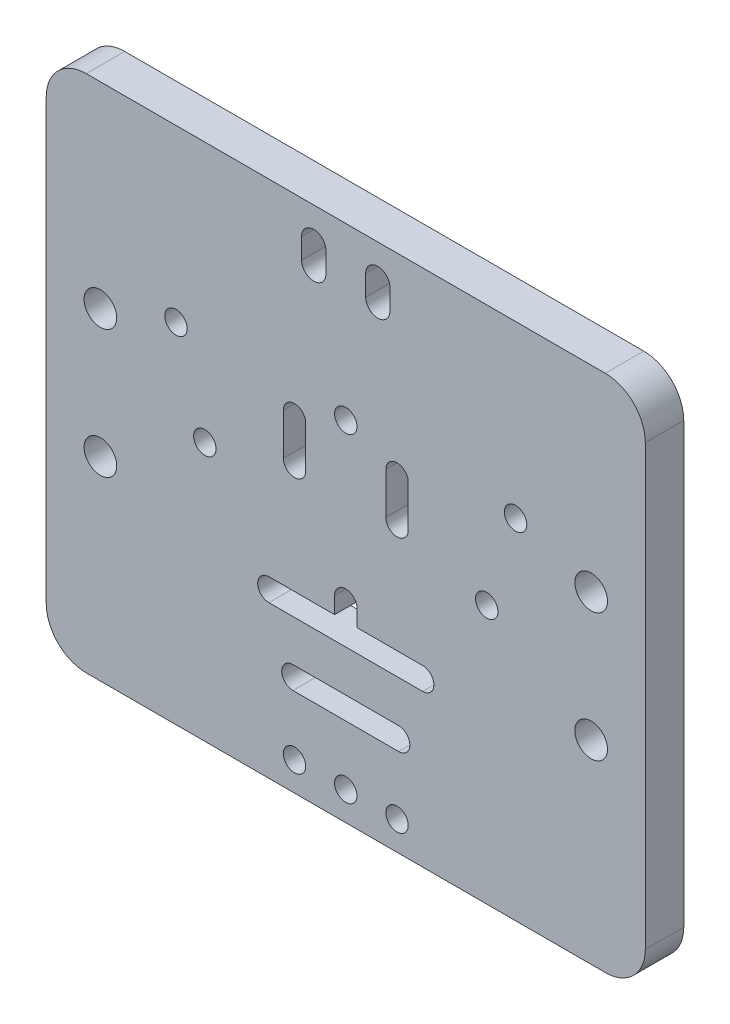
from build123d import *

# Parameters (mm, degrees)
MODEL_R    = 1.75
MODEL_R_2  = 2.55
BASE_DEPTH = 6


with BuildPart() as part:
    # Model → Base (new body)
    with BuildSketch(Plane.XY):
        with BuildLine():
            Line((46.75, 74.75), (46.75, 6.25))
            ThreePointArc((46.75, 6.25), (44.919417382, 1.830582618), (40.5, 0))
            Line((40.5, 0), (-40.5, 0))
            ThreePointArc((-40.5, 0), (-44.919417382, 1.830582618), (-46.75, 6.25))
            Line((-46.75, 6.25), (-46.75, 74.75))
            ThreePointArc((-46.75, 74.75), (-44.919417382, 79.169417382), (-40.5, 81))
            Line((-40.5, 81), (40.5, 81))
            ThreePointArc((40.5, 81), (44.919417382, 79.169417382), (46.75, 74.75))
        make_face()
        with Locations((0, 4.5)):
            Circle(MODEL_R, mode=Mode.SUBTRACT)
        with Locations((8, 4.5)):
            Circle(MODEL_R, mode=Mode.SUBTRACT)
        with Locations((38.3, 50.35)):
            Circle(MODEL_R_2, mode=Mode.SUBTRACT)
        with Locations((38.3, 30.35)):
            Circle(MODEL_R_2, mode=Mode.SUBTRACT)
        with Locations((-38.3, 30.35)):
            Circle(MODEL_R_2, mode=Mode.SUBTRACT)
        with Locations((-38.3, 50.35)):
            Circle(MODEL_R_2, mode=Mode.SUBTRACT)
        with Locations((-8, 4.5)):
            Circle(MODEL_R, mode=Mode.SUBTRACT)
        with Locations((0, 54.4)):
            Circle(MODEL_R, mode=Mode.SUBTRACT)
        with Locations((26.5, 54.4)):
            Circle(MODEL_R, mode=Mode.SUBTRACT)
        with Locations((22, 40.4)):
            Circle(MODEL_R, mode=Mode.SUBTRACT)
        with Locations((-22, 40.4)):
            Circle(MODEL_R, mode=Mode.SUBTRACT)
        with Locations((-26.5, 54.4)):
            Circle(MODEL_R, mode=Mode.SUBTRACT)
        with BuildLine():
            Line((-3.1, 75.8), (-3.1, 72.6))
            ThreePointArc((-3.1, 72.6), (-5, 70.7), (-6.9, 72.6))
            Line((-6.9, 72.6), (-6.9, 75.8))
            ThreePointArc((-6.9, 75.8), (-5, 77.7), (-3.1, 75.8))
        make_face(mode=Mode.SUBTRACT)
        with BuildLine():
            Line((-9.75, 50.9), (-9.75, 44.4))
            ThreePointArc((-9.75, 44.4), (-8, 42.65), (-6.25, 44.4))
            Line((-6.25, 44.4), (-6.25, 50.9))
            ThreePointArc((-6.25, 50.9), (-8, 52.65), (-9.75, 50.9))
        make_face(mode=Mode.SUBTRACT)
        with BuildLine():
            Line((3.1, 72.6), (3.1, 75.8))
            ThreePointArc((3.1, 75.8), (5, 77.7), (6.9, 75.8))
            Line((6.9, 75.8), (6.9, 72.6))
            ThreePointArc((6.9, 72.6), (5, 70.7), (3.1, 72.6))
        make_face(mode=Mode.SUBTRACT)
        with BuildLine():
            Line((8.25, 17.25), (-8.25, 17.25))
            ThreePointArc((-8.25, 17.25), (-10, 15.5), (-8.25, 13.75))
            Line((-8.25, 13.75), (8.25, 13.75))
            ThreePointArc((8.25, 13.75), (10, 15.5), (8.25, 17.25))
        make_face(mode=Mode.SUBTRACT)
        with BuildLine():
            Line((9.75, 44.4), (9.75, 50.9))
            ThreePointArc((9.75, 50.9), (8, 52.65), (6.25, 50.9))
            Line((6.25, 50.9), (6.25, 44.4))
            ThreePointArc((6.25, 44.4), (8, 42.65), (9.75, 44.4))
        make_face(mode=Mode.SUBTRACT)
        with BuildLine():
            Line((-1.75, 29.85), (-1.75, 27.25))
            Line((-1.75, 27.25), (-12, 27.25))
            ThreePointArc((-12, 27.25), (-13.75, 25.5), (-12, 23.75))
            Line((-12, 23.75), (12, 23.75))
            ThreePointArc((12, 23.75), (13.75, 25.5), (12, 27.25))
            Line((12, 27.25), (1.75, 27.25))
            Line((1.75, 27.25), (1.75, 29.85))
            ThreePointArc((1.75, 29.85), (0, 31.6), (-1.75, 29.85))
        make_face(mode=Mode.SUBTRACT)
    extrude(amount=BASE_DEPTH)


solid = part.part
